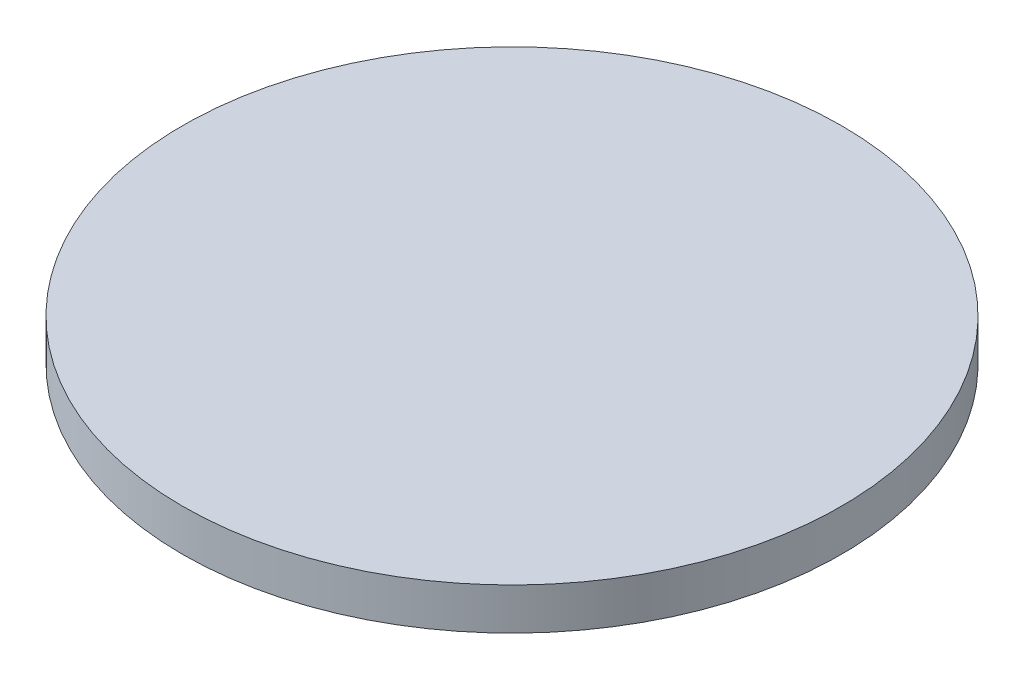
from build123d import *

# Parameters (mm, degrees)
SKETCH1_R           = 7.9
BOSS_EXTRUDE1_DEPTH = 1


with BuildPart() as part:
    # Sketch1 → Boss-Extrude1 (new body)
    with BuildSketch(Plane(origin=(0, 0, 0), x_dir=(1, 0, 0), z_dir=(0, 1, 0))):
        with Locations(Location((0, 0, 0), (0, 0, 270))):
            Circle(SKETCH1_R)
    extrude(amount=BOSS_EXTRUDE1_DEPTH)


solid = part.part
